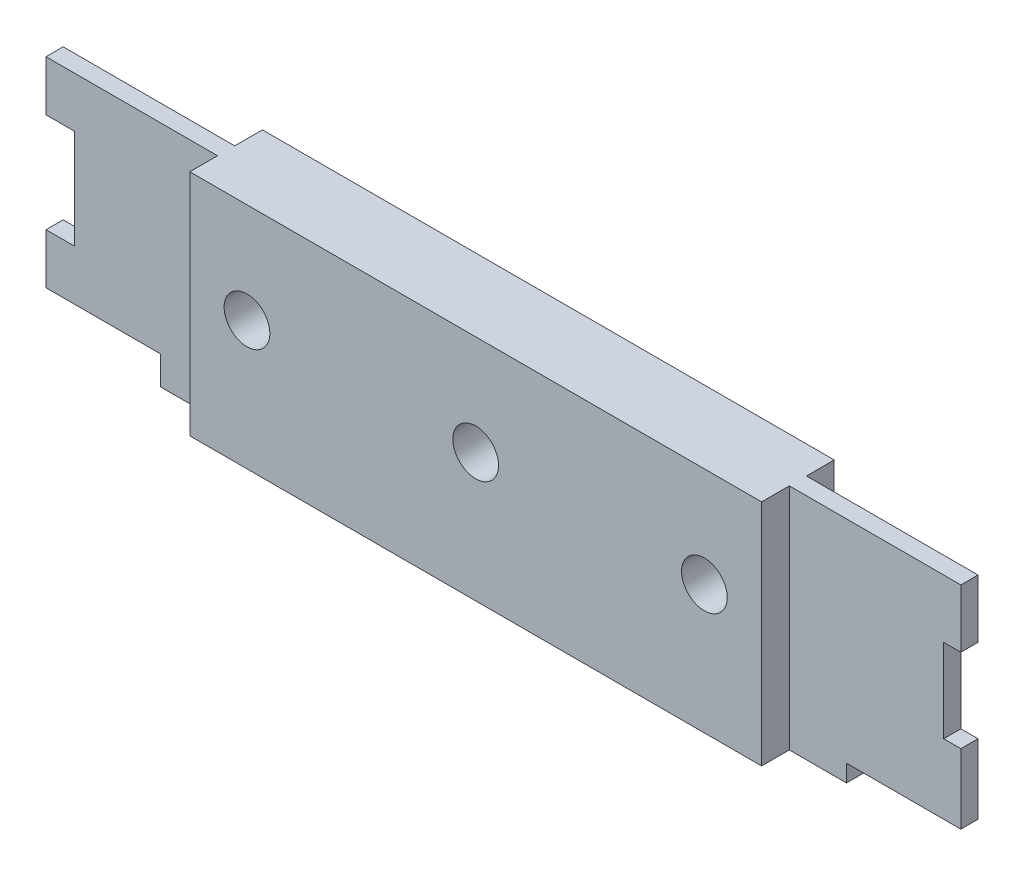
from build123d import *

# Parameters (mm, degrees)
CROQUIS1_R              = 2
SALIENTE_EXTRUIR1_DEPTH = 0.75
CROQUIS2_W              = 50
CROQUIS2_H              = 20
CROQUIS2_R              = 2
SALIENTE_EXTRUIR2_DEPTH = 3.175


with BuildPart() as part:
    # Croquis1 → Saliente-Extruir1 (new, symmetric)
    with BuildSketch(Plane.XY):
        Polygon((-40, 8.75), (40, 8.75), (40, 3.65), (38.5, 3.65), (38.5, -3.65), (40, -3.65), (40, -9.75), (30, -9.75), (30, -11.25), (-30, -11.25), (-30, -8.75), (-40, -8.75), (-40, -4.35), (-37.5, -4.35), (-37.5, 4.35), (-40, 4.35), align=None)
        with Locations((20, 0)):
            Circle(CROQUIS1_R, mode=Mode.SUBTRACT)
        Circle(CROQUIS1_R, mode=Mode.SUBTRACT)
        with Locations((-20, 0)):
            Circle(CROQUIS1_R, mode=Mode.SUBTRACT)
    extrude(amount=SALIENTE_EXTRUIR1_DEPTH, both=True)

    # Croquis2 → Saliente-Extruir2 (add, symmetric)
    with BuildSketch(Plane.XY):
        with Locations((0, -1.25)):
            Rectangle(CROQUIS2_W, CROQUIS2_H)
        with Locations((-20, 0)):
            Circle(CROQUIS2_R, mode=Mode.SUBTRACT)
        Circle(CROQUIS2_R, mode=Mode.SUBTRACT)
        with Locations((20, 0)):
            Circle(CROQUIS2_R, mode=Mode.SUBTRACT)
    extrude(amount=SALIENTE_EXTRUIR2_DEPTH, both=True)


solid = part.part
